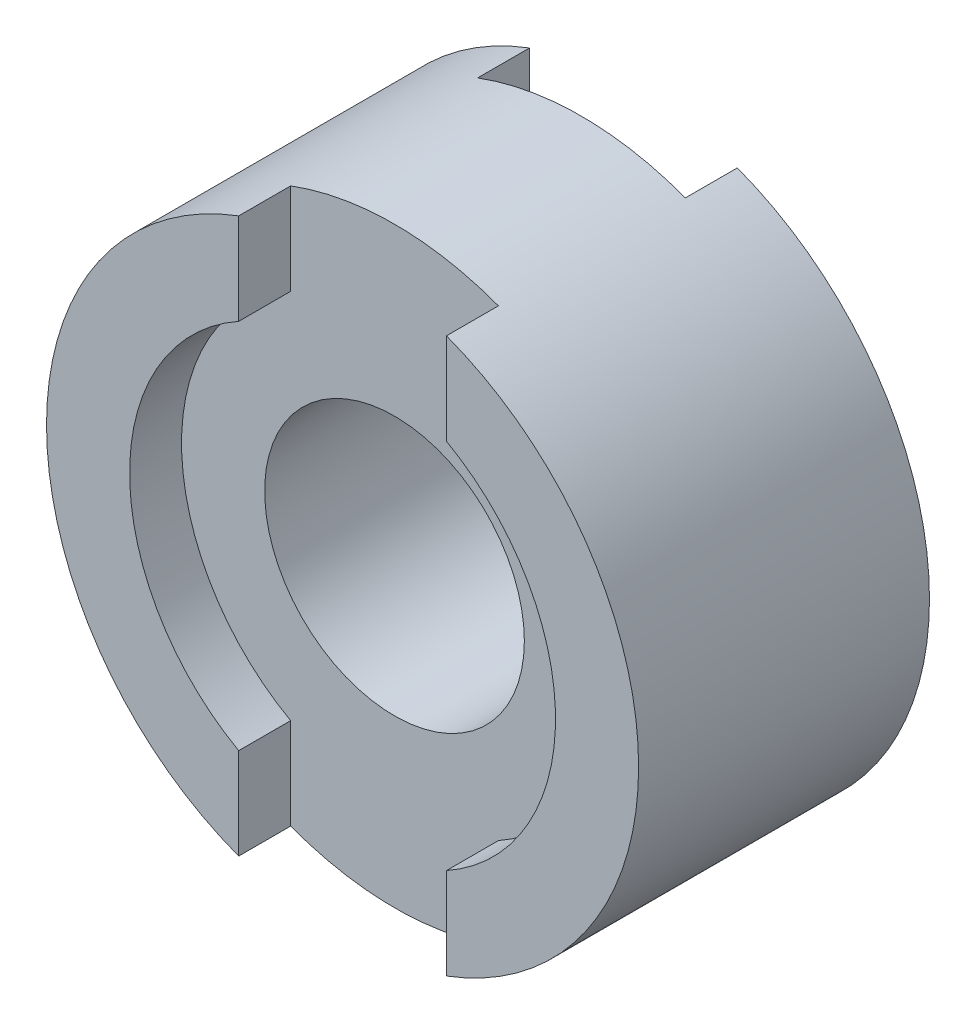
from build123d import *
from build123d.topology import SkipClean

# Parameters (mm, degrees)
SKETCH_1_R      = 2.85
SKETCH_1_R_2    = 1.25
EXTRUDE_1_DEPTH = 0.9
EXTRUDE_2_DEPTH = 0.5


with BuildPart() as part:
    # ｽｹｯﾁ1 → ﾎﾞｽ - 押し出し1 (new body)
    with BuildSketch(Plane.XY):
        Circle(SKETCH_1_R)
        Circle(SKETCH_1_R_2, mode=Mode.SUBTRACT)
    extrude_1 = extrude(amount=EXTRUDE_1_DEPTH)

    # ｽｹｯﾁ2 → ﾎﾞｽ - 押し出し2 (add)
    with SkipClean():  # the faces are left unmerged after this step: merging them gives an invalid solid
        with BuildSketch(Plane.XY.offset(0.9)):
            with BuildLine():
                Line((-1, 2.668801229), (-1, 1.789553017))
                ThreePointArc((-1, 1.789553017), (-2.05, 0), (-1, -1.789553017))
                Line((-1, -1.789553017), (-1, -2.668801229))
                ThreePointArc((-1, -2.668801229), (-2.85, 0), (-1, 2.668801229))
            make_face()
            with BuildLine():
                Line((1, 2.668801229), (1, 1.789553017))
                ThreePointArc((1, 1.789553017), (2.05, 0), (1, -1.789553017))
                Line((1, -1.789553017), (1, -2.668801229))
                ThreePointArc((1, -2.668801229), (2.85, 0), (1, 2.668801229))
            make_face()
        extrude_2 = extrude(amount=EXTRUDE_2_DEPTH)

    # ﾐﾗｰ1: ﾎﾞｽ - 押し出し1, ﾎﾞｽ - 押し出し2 across plane
    with SkipClean():  # the faces are left unmerged after this step: merging them gives an invalid solid
        add(extrude_1.mirror(Plane.XY))
        add(extrude_2.mirror(Plane.XY))


solid = part.part
